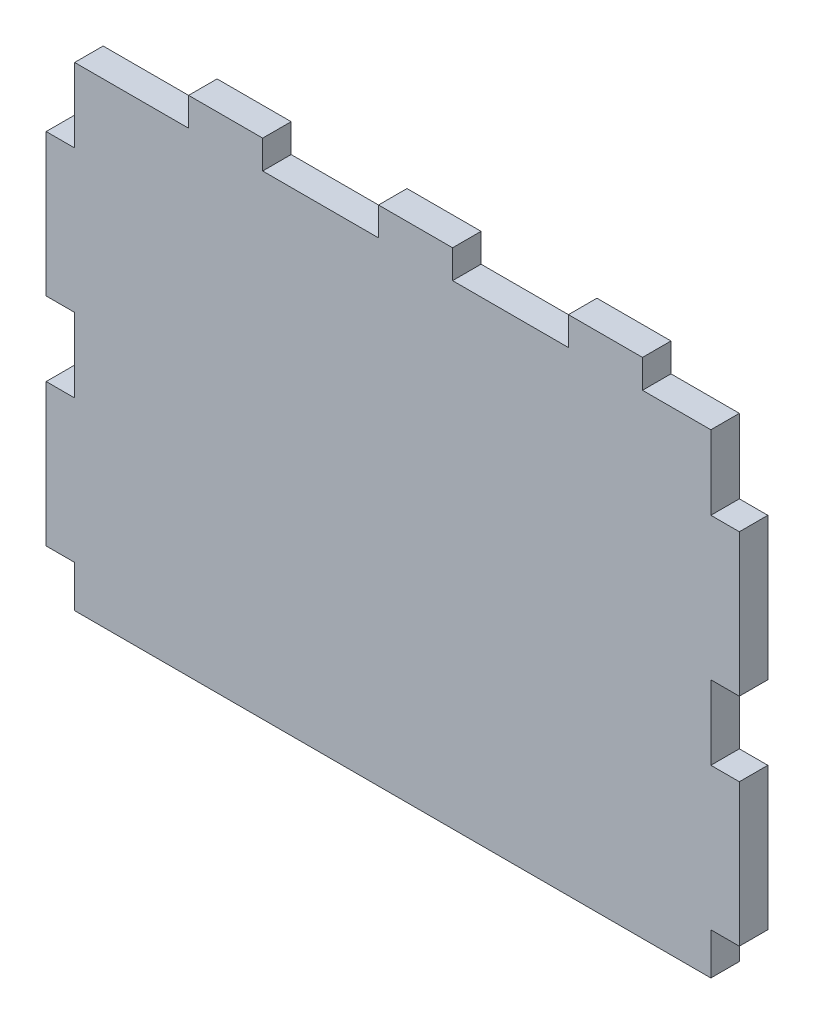
from build123d import *

# Parameters (mm, degrees)
SKETCH1_W           = 73
SKETCH1_H           = 50
BOSS_EXTRUDE1_DEPTH = 3
SKETCH2_W           = 3
SKETCH2_H           = 7.8
CUT_EXTRUDE1_DEPTH  = 53.999062732
LPATTERN1_COUNT     = 3
LPATTERN1_PITCH     = 22.8
SKETCH3_W           = 3
SKETCH3_H           = 7.8
CUT_EXTRUDE2_DEPTH  = 53.999062732
LPATTERN2_COUNT     = 4
LPATTERN2_PITCH     = 22.8
SKETCH6_W           = 3
SKETCH6_H           = 19.4
CUT_EXTRUDE3_DEPTH  = 10
SKETCH7_W           = 7.8
SKETCH7_H           = 3
BOSS_EXTRUDE2_DEPTH = 3
LPATTERN3_COUNT     = 3
LPATTERN3_PITCH     = 20
SKETCH8_W           = 3
SKETCH8_H           = 15
BOSS_EXTRUDE3_DEPTH = 3


with BuildPart() as part:
    # Sketch1 → Boss-Extrude1 (new body)
    with BuildSketch(Plane.XY):
        with Locations((-4.493460648, -8.457986111)):
            Rectangle(SKETCH1_W, SKETCH1_H)
    extrude(amount=BOSS_EXTRUDE1_DEPTH)

    # Sketch2 → Cut-Extrude1 (cut, through all)
    with BuildSketch(Plane.XY.offset(3)):
        with Locations((-39.493460648, 12.642013889)):
            Rectangle(SKETCH2_W, SKETCH2_H)
    cut_extrude1 = extrude(amount=-CUT_EXTRUDE1_DEPTH, mode=Mode.SUBTRACT)

    # LPattern1: Cut-Extrude1 ×3
    with Locations(*[(0, -i * LPATTERN1_PITCH, 0) for i in range(1, LPATTERN1_COUNT)]):
        add(cut_extrude1, mode=Mode.SUBTRACT)

    # Sketch3 → Cut-Extrude2 (cut, through all)
    with BuildSketch(Plane.XY.offset(3)):
        with Locations((30.506539352, 12.642013889)):
            Rectangle(SKETCH3_W, SKETCH3_H)
    cut_extrude2 = extrude(amount=-CUT_EXTRUDE2_DEPTH, mode=Mode.SUBTRACT)

    # LPattern2: Cut-Extrude2 ×4
    with Locations(*[(0, -i * LPATTERN2_PITCH, 0) for i in range(1, LPATTERN2_COUNT)]):
        add(cut_extrude2, mode=Mode.SUBTRACT)

    # Sketch6 → Cut-Extrude3 (cut)
    with BuildSketch(Plane.XY.offset(3)):
        with Locations((-39.493460648, -23.757986111)):
            Rectangle(SKETCH6_W, SKETCH6_H)
    extrude(amount=-CUT_EXTRUDE3_DEPTH, mode=Mode.SUBTRACT)

    # Sketch7 → Boss-Extrude2 (add)
    with BuildSketch(Plane(origin=(0, 16.542013889, 0), x_dir=(1, 0, 0), z_dir=(0, 1, 0))):
        with Locations((-22.093460648, -1.5)):
            Rectangle(SKETCH7_W, SKETCH7_H)
    boss_extrude2 = extrude(amount=BOSS_EXTRUDE2_DEPTH)

    # LPattern3: Boss-Extrude2 ×3
    with Locations(*[(i * LPATTERN3_PITCH, 0, 0) for i in range(1, LPATTERN3_COUNT)]):
        add(boss_extrude2)

    # Sketch8 → Boss-Extrude3 (add)
    with BuildSketch(Plane.ZY.offset(37.993460648)):
        with Locations((1.5, -21.557986111)):
            Rectangle(SKETCH8_W, SKETCH8_H)
    extrude(amount=BOSS_EXTRUDE3_DEPTH)


solid = part.part
